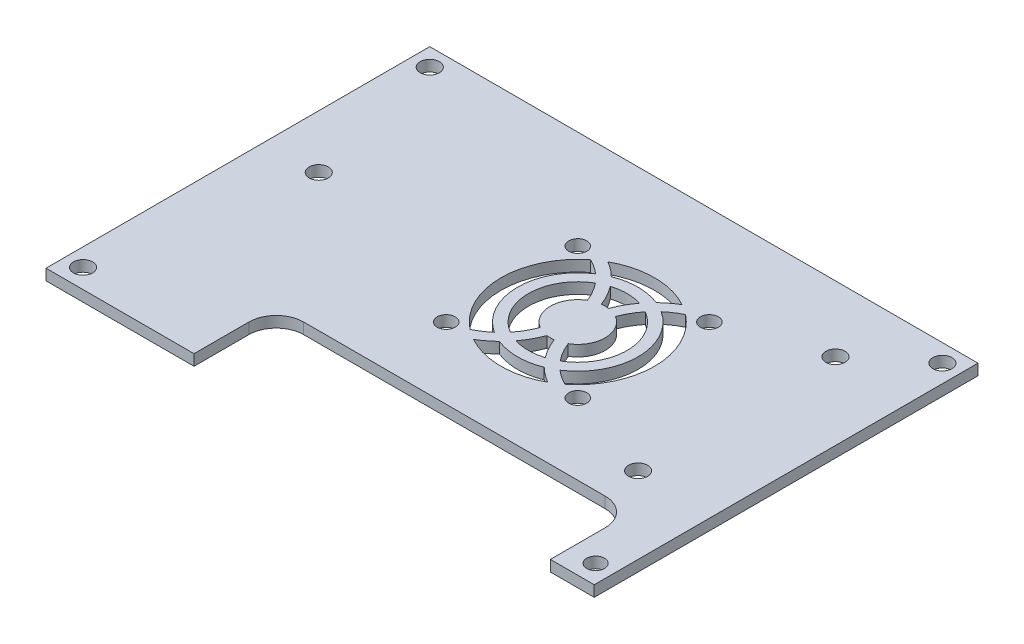
from build123d import *

# Parameters (mm, degrees)
SKETCH1_W           = 100
SKETCH1_H           = 70
SKETCH1_R           = 1.75
SKETCH1_R_2         = 1.625
SKETCH1_R_3         = 14
SKETCH1_R_4         = 1.65
BOSS_EXTRUDE2_DEPTH = 2
CUT_EXTRUDE1_REACH  = 63.066
BOSS_EXTRUDE5_START = -2
BOSS_EXTRUDE5_DEPTH = 2
SKETCH11_R          = 1.75
CUT_EXTRUDE3_DEPTH  = 62.065538563


with BuildPart() as part:
    # Sketch1 → Boss-Extrude2 (new body)
    with BuildSketch(Plane(origin=(0, 0, 0), x_dir=(1, 0, 0), z_dir=(0, 1, 0))):
        Rectangle(SKETCH1_W, SKETCH1_H)
        with Locations(Location((-46.75, 31.75, 0), (0, 0, 270))):
            Circle(SKETCH1_R, mode=Mode.SUBTRACT)
        with Locations(Location((46.75, 31.75, 0), (0, 0, 90))):
            Circle(SKETCH1_R, mode=Mode.SUBTRACT)
        with Locations(Location((-46.75, -31.5, 0), (0, 0, 270))):
            Circle(SKETCH1_R, mode=Mode.SUBTRACT)
        with Locations(Location((46.75, -31.5, 0), (0, 0, 270))):
            Circle(SKETCH1_R_2, mode=Mode.SUBTRACT)
        with Locations(Location((7, 5, 0), (0, 0, 270))):
            Circle(SKETCH1_R_3, mode=Mode.SUBTRACT)
        with Locations(Location((-5, 17, 0), (0, 0, 270))):
            Circle(SKETCH1_R_4, mode=Mode.SUBTRACT)
        with Locations(Location((-5, -7, 0), (0, 0, 90))):
            Circle(SKETCH1_R_4, mode=Mode.SUBTRACT)
        with Locations(Location((19, -7, 0), (0, 0, 270))):
            Circle(SKETCH1_R_4, mode=Mode.SUBTRACT)
        with Locations(Location((19, 17, 0), (0, 0, 90))):
            Circle(SKETCH1_R_4, mode=Mode.SUBTRACT)
    extrude(amount=BOSS_EXTRUDE2_DEPTH)

    # Sketch2 → Cut-Extrude1 (cut, up to next)
    with BuildSketch(Plane(origin=(0, 2, 0), x_dir=(1, 0, 0), z_dir=(0, 1, 0)), mode=Mode.PRIVATE) as cut_extrude1_sk1:
        with BuildLine():
            Line((-18, -20), (37, -20))
            ThreePointArc((37, -20), (40.535533906, -21.464466094), (42, -25))
            Line((42, -25), (42, -35))
            Line((42, -35), (-23, -35))
            Line((-23, -35), (-23, -25))
            ThreePointArc((-23, -25), (-21.535533906, -21.464466094), (-18, -20))
        make_face()
    cut_extrude1_tool1 = extrude(cut_extrude1_sk1.sketch, amount=-CUT_EXTRUDE1_REACH, mode=Mode.PRIVATE) & part.part
    add(cut_extrude1_tool1.solids().sort_by_distance((9.5, 2, 27.57103))[0], mode=Mode.SUBTRACT)

    # Sketch3 → Boss-Extrude5 (add)
    with BuildSketch(Plane(origin=(0, 2, 0), x_dir=(1, 0, 0), z_dir=(0, 1, 0)).offset(BOSS_EXTRUDE5_START)):
        with BuildLine():
            ThreePointArc((2.907966853, -5.21054674), (7, -6), (11.092033147, -5.21054674))
            ThreePointArc((11.092033147, -5.21054674), (12.370622562, -6.311804318), (13.770604576, -7.25393462))
            ThreePointArc((13.770604576, -7.25393462), (14.740861541, -6.665293078), (15.660254038, -6))
            ThreePointArc((15.660254038, -6), (14.262684823, -5.203992902), (12.981682609, -4.231439387))
            ThreePointArc((12.981682609, -4.231439387), (18, 5), (12.981682609, 14.231439387))
            ThreePointArc((12.981682609, 14.231439387), (14.262684823, 15.203992902), (15.660254038, 16))
            ThreePointArc((15.660254038, 16), (14.740861541, 16.665293078), (13.770604576, 17.25393462))
            ThreePointArc((13.770604576, 17.25393462), (12.370622562, 16.311804318), (11.092033147, 15.21054674))
            ThreePointArc((11.092033147, 15.21054674), (7, 16), (2.907966853, 15.21054674))
            ThreePointArc((2.907966853, 15.21054674), (1.629377438, 16.311804318), (0.229395424, 17.25393462))
            ThreePointArc((0.229395424, 17.25393462), (-0.740861541, 16.665293078), (-1.660254038, 16))
            ThreePointArc((-1.660254038, 16), (-0.262684823, 15.203992902), (1.018317391, 14.231439387))
            ThreePointArc((1.018317391, 14.231439387), (-4, 5), (1.018317391, -4.231439387))
            ThreePointArc((1.018317391, -4.231439387), (-0.262684823, -5.203992902), (-1.660254038, -6))
            ThreePointArc((-1.660254038, -6), (-0.740861541, -6.665293078), (0.229395424, -7.25393462))
            ThreePointArc((0.229395424, -7.25393462), (1.629377438, -6.311804318), (2.907966853, -5.21054674))
        make_face()
        with BuildLine():
            ThreePointArc((6.336538282, 0.04421363), (7, 0), (7.663461718, 0.04421363))
            ThreePointArc((7.663461718, 0.04421363), (8.529854537, -1.849711236), (9.663461718, -3.596858244))
            ThreePointArc((9.663461718, -3.596858244), (7, -4), (4.336538282, -3.596858244))
            ThreePointArc((4.336538282, -3.596858244), (5.470145463, -1.849711236), (6.336538282, 0.04421363))
        make_face(mode=Mode.SUBTRACT)
        with BuildLine():
            ThreePointArc((4.446888819, 9.299025855), (2, 5), (4.446888819, 0.700974145))
            ThreePointArc((4.446888819, 0.700974145), (3.589514818, -1.113514772), (2.446888819, -2.763322651))
            ThreePointArc((2.446888819, -2.763322651), (-2, 5), (2.446888819, 12.763322651))
            ThreePointArc((2.446888819, 12.763322651), (3.589514818, 11.113514772), (4.446888819, 9.299025855))
        make_face(mode=Mode.SUBTRACT)
        with BuildLine():
            ThreePointArc((9.663461718, 13.596858244), (8.529854537, 11.849711236), (7.663461718, 9.95578637))
            ThreePointArc((7.663461718, 9.95578637), (7, 10), (6.336538282, 9.95578637))
            ThreePointArc((6.336538282, 9.95578637), (5.470145463, 11.849711236), (4.336538282, 13.596858244))
            ThreePointArc((4.336538282, 13.596858244), (7, 14), (9.663461718, 13.596858244))
        make_face(mode=Mode.SUBTRACT)
        with BuildLine():
            ThreePointArc((11.553111181, -2.763322651), (10.410485182, -1.113514772), (9.553111181, 0.700974145))
            ThreePointArc((9.553111181, 0.700974145), (12, 5), (9.553111181, 9.299025855))
            ThreePointArc((9.553111181, 9.299025855), (10.410485182, 11.113514772), (11.553111181, 12.763322651))
            ThreePointArc((11.553111181, 12.763322651), (16, 5), (11.553111181, -2.763322651))
        make_face(mode=Mode.SUBTRACT)
    extrude(amount=BOSS_EXTRUDE5_DEPTH)

    # Sketch11 → Cut-Extrude3 (cut, through all)
    with BuildSketch(Plane(origin=(0, 2, 0), x_dir=(1, 0, 0), z_dir=(0, 1, 0))):
        with Locations(Location((-40.25, 5, 0), (0, 0, 90))):
            Circle(SKETCH11_R)
        with Locations(Location((36, 23, 0), (0, 0, 90))):
            Circle(SKETCH11_R)
        with Locations(Location((36, -13, 0), (0, 0, 90))):
            Circle(SKETCH11_R)
    extrude(amount=-CUT_EXTRUDE3_DEPTH, mode=Mode.SUBTRACT)


solid = part.part
